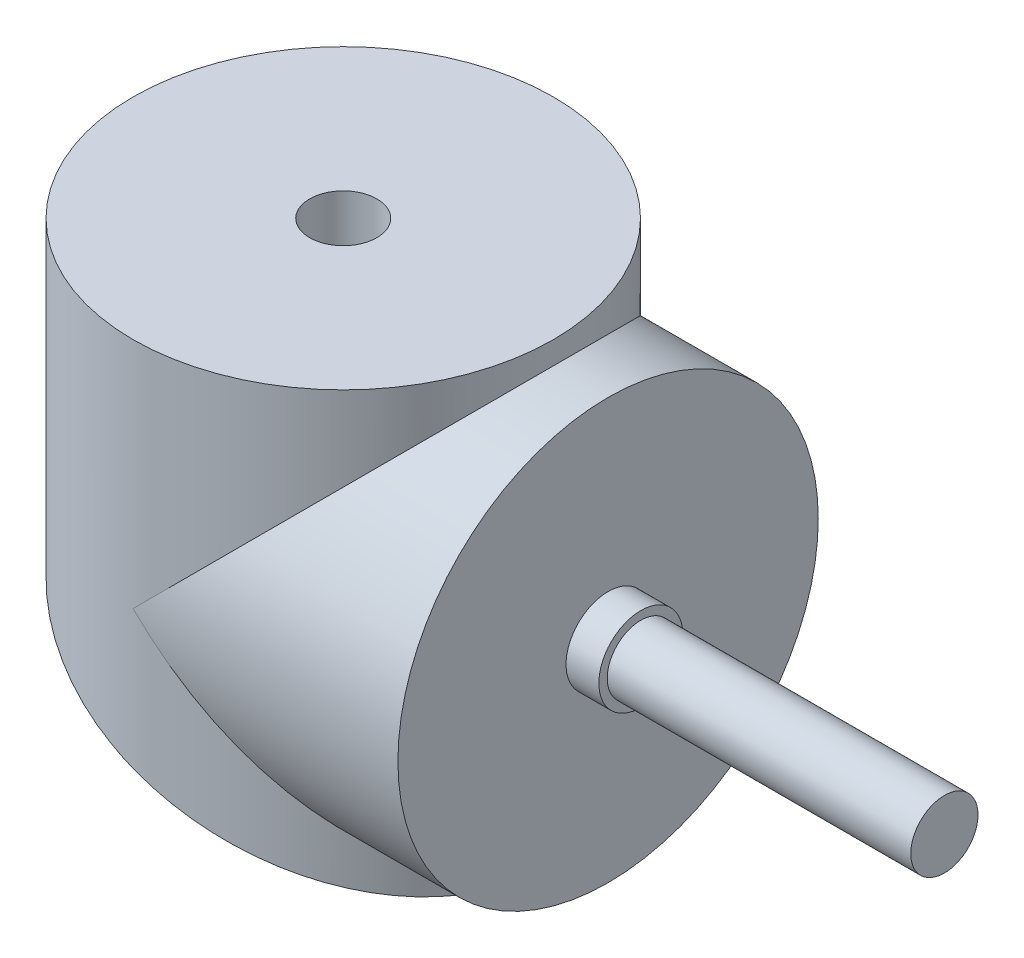
from build123d import *

# Parameters (mm, degrees)
SKETCH1_R                = 37.5
BOSS_EXTRUDE1_DEPTH      = 47.25
BOSS_EXTRUDE2_DEPTH      = 41.55
BOSS_EXTRUDE2_DEPTH_BACK = 39.70459341
SKETCH2_R                = 37.5
CUT_EXTRUDE1_DEPTH       = 74.247627948
CUT_EXTRUDE1_DEPTH_BACK  = 74.247627948
SKETCH4_R                = 6
BOSS_EXTRUDE3_DEPTH      = 60
SKETCH5_R                = 7.5
BOSS_EXTRUDE4_DEPTH      = 5.85
CUT_EXTRUDE2_DEPTH       = 140.682215941
CUT_EXTRUDE2_DEPTH_BACK  = 58.15
SKETCH6_R                = 6


with BuildPart() as part:
    # Sketch1 → Boss-Extrude1 (new body)
    with BuildSketch(Plane(origin=(0, 0, 0), x_dir=(0, 0, -1), z_dir=(1, 0, 0))):
        Circle(SKETCH1_R)
    extrude(amount=BOSS_EXTRUDE1_DEPTH)

    # Sketch2 → Boss-Extrude2 (add, two sides: drawn at the far end of the back side and taken through both)
    with BuildSketch(Plane(origin=(0, 0, 0), x_dir=(1, 0, 0), z_dir=(0, 1, 0)).offset(-BOSS_EXTRUDE2_DEPTH_BACK)):
        with Locations(Location((0, 0, 0), (0, 0, 270))):
            Circle(SKETCH2_R)
    extrude(amount=BOSS_EXTRUDE2_DEPTH + BOSS_EXTRUDE2_DEPTH_BACK)

    # Sketch3 → Cut-Extrude1 (cut, two sides: drawn at the far end of the back side and taken through both)
    with BuildSketch(Plane.XY.offset(-CUT_EXTRUDE1_DEPTH_BACK)):
        Polygon((37.5, -39.70459341), (-37.5, -39.70459341), (-37.5, -9.70456466), align=None)
    extrude(amount=CUT_EXTRUDE1_DEPTH + CUT_EXTRUDE1_DEPTH_BACK, mode=Mode.SUBTRACT)

    # Sketch4 → Boss-Extrude3 (add)
    with BuildSketch(Plane(origin=(47.25, 0, 0), x_dir=(0, 0, -1), z_dir=(1, 0, 0))):
        Circle(SKETCH4_R)
    extrude(amount=BOSS_EXTRUDE3_DEPTH)

    # Sketch5 → Boss-Extrude4 (add)
    with BuildSketch(Plane(origin=(47.25, 0, 0), x_dir=(0, 0, -1), z_dir=(1, 0, 0))):
        Circle(SKETCH5_R)
    extrude(amount=BOSS_EXTRUDE4_DEPTH)

    # Sketch6 → Cut-Extrude2 (cut, two sides: drawn at the far end of the back side and taken through both)
    with BuildSketch(Plane(origin=(0, 41.55, 0), x_dir=(1, 0, 0), z_dir=(0, 1, 0)).offset(-CUT_EXTRUDE2_DEPTH_BACK)):
        with Locations(Location((0, 0, 0), (0, 0, 90))):
            Circle(SKETCH6_R)
    extrude(amount=CUT_EXTRUDE2_DEPTH + CUT_EXTRUDE2_DEPTH_BACK, mode=Mode.SUBTRACT)


solid = part.part
